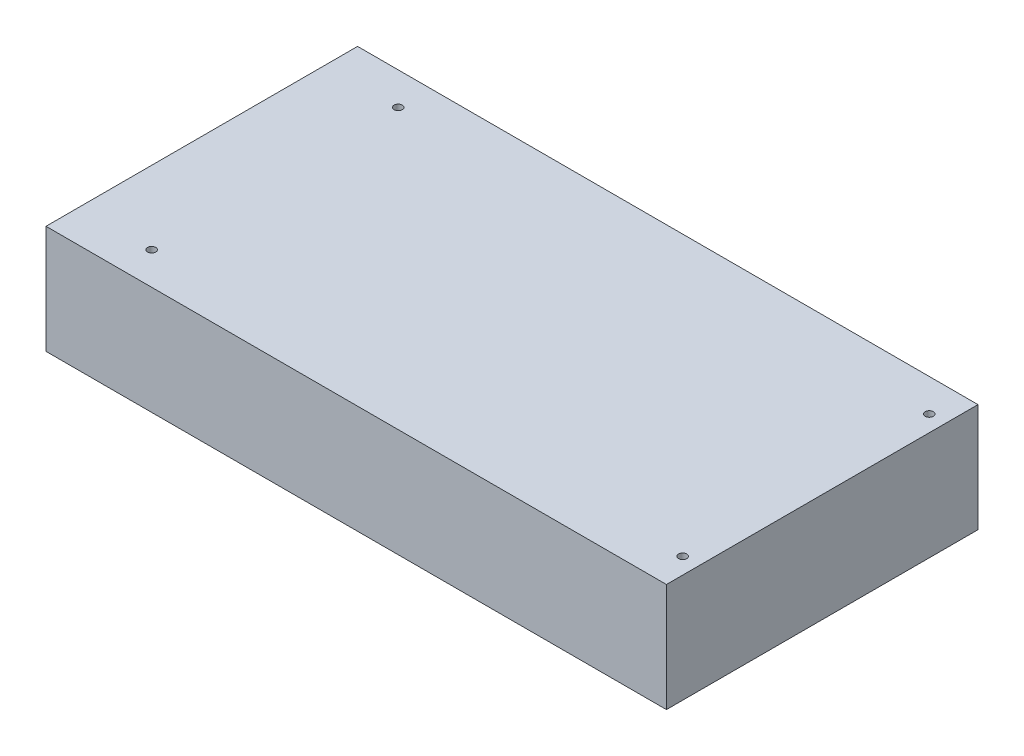
from build123d import *

# Parameters (mm, degrees)
SKETCH_1_W      = 229
SKETCH_1_H      = 115
SKETCH_1_R      = 1.5
EXTRUDE_1_DEPTH = 40


with BuildPart() as part:
    # 草图1 → 凸台-拉伸1 (new body)
    with BuildSketch(Plane(origin=(0, 0, 0), x_dir=(1, 0, 0), z_dir=(0, 1, 0))):
        with Locations((113.28975623, -22.19835875)):
            Rectangle(SKETCH_1_W, SKETCH_1_H)
        with Locations(Location((25.78975623, 23.30164125, 0), (0, 0, 270))):
            Circle(SKETCH_1_R, mode=Mode.SUBTRACT)
        with Locations(Location((25.78975623, -67.69835875, 0), (0, 0, 270))):
            Circle(SKETCH_1_R, mode=Mode.SUBTRACT)
        with Locations(Location((221.78975623, 23.30164125, 0), (0, 0, 270))):
            Circle(SKETCH_1_R, mode=Mode.SUBTRACT)
        with Locations(Location((221.78975623, -67.69835875, 0), (0, 0, 270))):
            Circle(SKETCH_1_R, mode=Mode.SUBTRACT)
    extrude(amount=EXTRUDE_1_DEPTH)


solid = part.part
